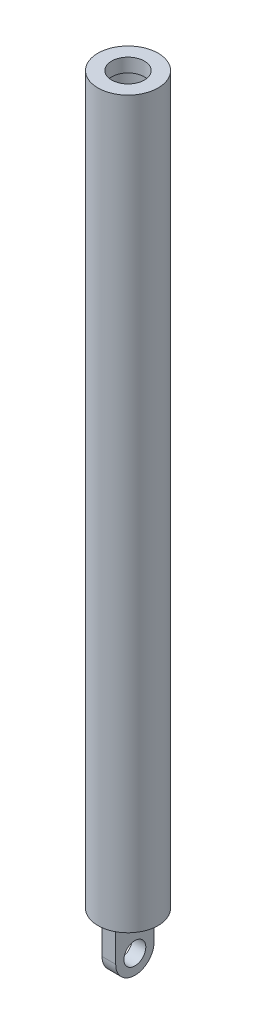
from build123d import *

# Parameters (mm, degrees)
SKETCH_1_R      = 11
SKETCH_1_R_2    = 9
EXTRUDE_1_DEPTH = 248
EXTRUDE_START   = 12
SKETCH_2_R      = 11
EXTRUDE_2_DEPTH = 12
SKETCH_4_R      = 4
EXTRUDE_4_DEPTH = 2.5
SKETCH_5_R      = 11
SKETCH_5_R_2    = 6
EXTRUDE_5_DEPTH = 5


with BuildPart() as part:
    # 草圖1 → 填料-伸長1 (new body)
    with BuildSketch(Plane(origin=(0, 0, 0), x_dir=(1, 0, 0), z_dir=(0, 1, 0))):
        with Locations(Location((0, 0, 0), (0, 0, 270))):
            Circle(SKETCH_1_R)
        with Locations(Location((0, 0, 0), (0, 0, 270))):
            Circle(SKETCH_1_R_2, mode=Mode.SUBTRACT)
    extrude(amount=EXTRUDE_1_DEPTH)

    # 草圖2 → 填料-伸長2 (add)
    with BuildSketch(Plane.XZ.offset(EXTRUDE_START)):
        with Locations(Location((0, 0, 0), (0, 0, 270))):
            Circle(SKETCH_2_R)
    extrude(amount=-EXTRUDE_2_DEPTH)

    # 草圖4 → 填料-伸長4 (add, symmetric)
    with BuildSketch(Plane(origin=(0, 0, 0), x_dir=(0, 0, -1), z_dir=(1, 0, 0))):
        with BuildLine():
            Line((-7, -12), (-7, -25))
            ThreePointArc((-7, -25), (0, -32), (7, -25))
            Line((7, -25), (7, -12))
            Line((7, -12), (-7, -12))
        make_face()
        with Locations((0, -25)):
            Circle(SKETCH_4_R, mode=Mode.SUBTRACT)
    extrude(amount=EXTRUDE_4_DEPTH, both=True)

    # 草圖5 → 填料-伸長5 (add)
    with BuildSketch(Plane(origin=(0, 248, 0), x_dir=(1, 0, 0), z_dir=(0, 1, 0))):
        with Locations(Location((0, 0, 0), (0, 0, 90))):
            Circle(SKETCH_5_R)
        with Locations(Location((0, 0, 0), (0, 0, 270))):
            Circle(SKETCH_5_R_2, mode=Mode.SUBTRACT)
    extrude(amount=EXTRUDE_5_DEPTH)


solid = part.part
